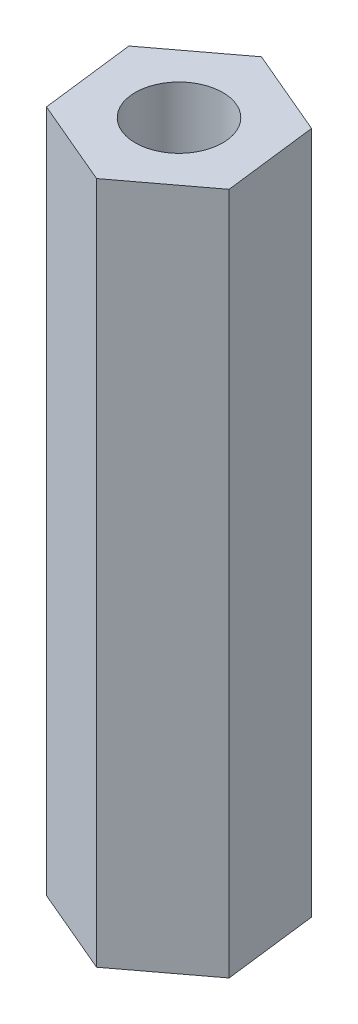
from build123d import *

# Parameters (mm, degrees)
SKETCH_1_R      = 1.6
EXTRUDE_1_DEPTH = 25


with BuildPart() as part:
    # 草图1 → 凸台-拉伸1 (new body)
    with BuildSketch(Plane(origin=(0, 0, 0), x_dir=(1, 0, 0), z_dir=(0, 1, 0))):
        Polygon((2.767176381, 2.083922954), (-0.421142027, 3.438406519), (-3.188318408, 1.354483566), (-2.767176381, -2.083922954), (0.421142027, -3.438406519), (3.188318408, -1.354483566), align=None)
        with Locations(Location((0, 0, 0), (0, 0, 270))):
            Circle(SKETCH_1_R, mode=Mode.SUBTRACT)
    extrude(amount=EXTRUDE_1_DEPTH)


solid = part.part
